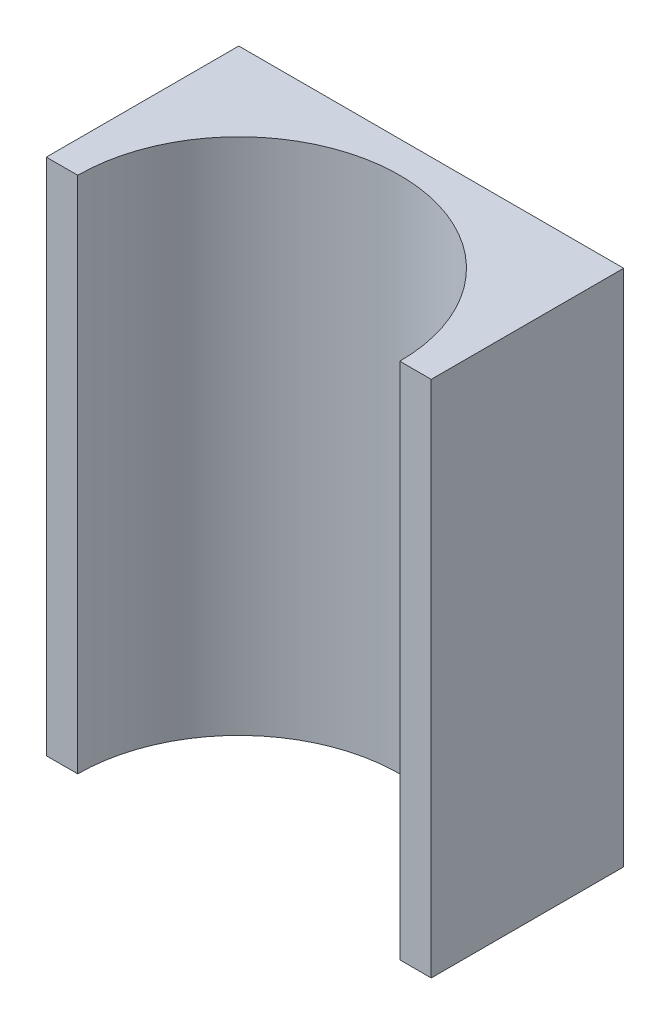
from build123d import *

# Parameters (mm, degrees)
BOSS_EXTRUDE1_DEPTH = 132


with BuildPart() as part:
    # Sketch1 → Boss-Extrude1 (new body)
    with BuildSketch(Plane(origin=(0, 0, 0), x_dir=(1, 0, 0), z_dir=(0, 1, 0))):
        with BuildLine():
            Line((41, -24.5), (49, -24.5))
            Line((49, -24.5), (49, 24.5))
            Line((49, 24.5), (-49, 24.5))
            Line((-49, 24.5), (-49, -24.5))
            Line((-49, -24.5), (-41, -24.5))
            ThreePointArc((-41, -24.5), (0, 16.5), (41, -24.5))
        make_face()
    extrude(amount=BOSS_EXTRUDE1_DEPTH)


solid = part.part
